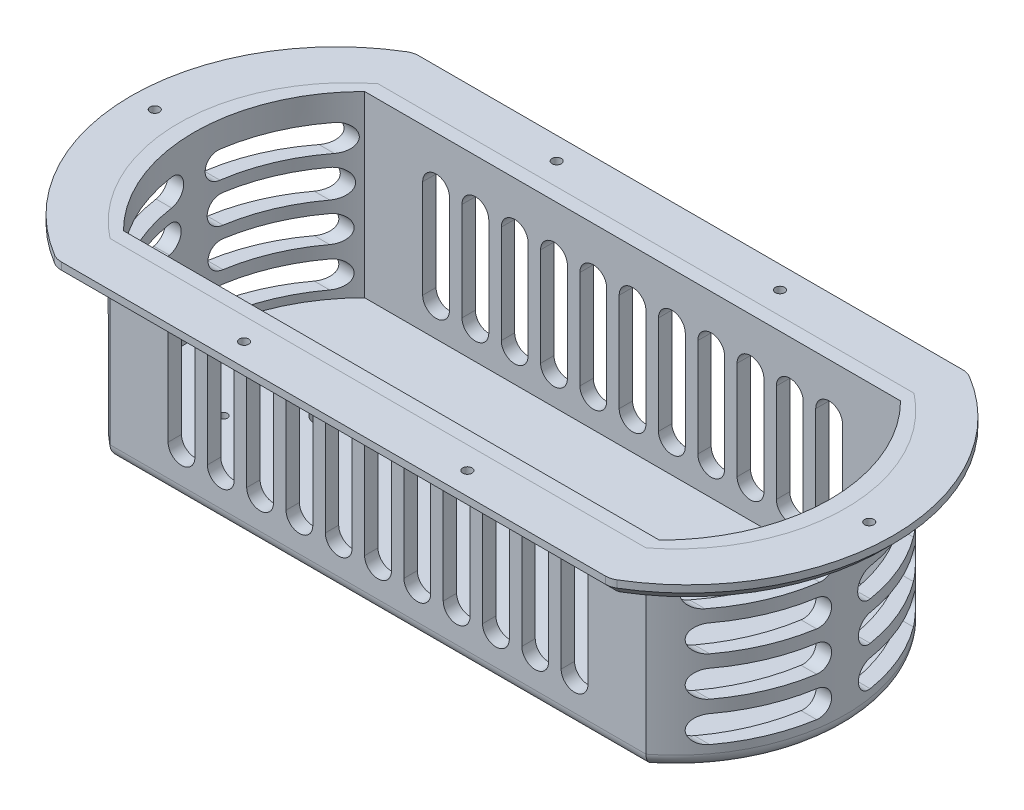
from build123d import *

# Parameters (mm, degrees)
BOSS_EXTRUDE1_DEPTH      = 10
BOSS_EXTRUDE2_DEPTH      = 100
CUT_EXTRUDE1_DEPTH       = 85
FILLET2_R                = 10
SKETCH10_R               = 4.6
CUT_EXTRUDE2_DEPTH       = 5
SKETCH10_3_R             = 4.6
CUT_EXTRUDE3_DEPTH       = 5
SKETCH10_4_R             = 4.6
CUT_EXTRUDE4_DEPTH       = 5
SKETCH10_5_R             = 4.6
CUT_EXTRUDE5_DEPTH       = 5
SKETCH10_6_R             = 4.6
CUT_EXTRUDE6_DEPTH       = 5
SKETCH10_7_R             = 4.6
CUT_EXTRUDE7_DEPTH       = 5
SKETCH12_R               = 2.6
CUT_EXTRUDE8_DEPTH       = 5
SKETCH12_3_R             = 2.6
CUT_EXTRUDE9_DEPTH       = 5
SKETCH12_4_R             = 2.6
CUT_EXTRUDE10_DEPTH      = 5
SKETCH12_5_R             = 2.6
CUT_EXTRUDE11_DEPTH      = 5
SKETCH12_6_R             = 2.6
CUT_EXTRUDE12_DEPTH      = 5
SKETCH12_7_R             = 2.6
CUT_EXTRUDE13_DEPTH      = 5
BOSS_EXTRUDE3_START      = 7.5
BOSS_EXTRUDE3_DEPTH      = 7.5
FILLET4_R                = 7.5
CUT_EXTRUDE17_DEPTH      = 15
CUT_EXTRUDE19_DEPTH      = 293.557934352
SKETCH46_R               = 2.35
CUT_EXTRUDE20_DEPTH      = 10
CUT_EXTRUDE21_DEPTH      = 190
CHAMFER1_SIZE            = 6
CUT_EXTRUDE23_START      = -100
CUT_EXTRUDE23_DEPTH      = 100
CUT_EXTRUDE26_DEPTH      = 259.872835489
CUT_EXTRUDE26_DEPTH_BACK = 259.872835489
SKETCH52_R               = 7.5


with BuildPart() as part:
    # Sketch2 → Boss-Extrude1 (new body)
    with BuildSketch(Plane(origin=(0, 0, 0), x_dir=(1, 0, 0), z_dir=(0, 1, 0))):
        with BuildLine():
            Line((-155, 100), (155, 100))
            ThreePointArc((155, 100), (213.210916542, 0), (155, -100))
            Line((155, -100), (-155, -100))
            ThreePointArc((-155, -100), (-213.210916542, 0), (-155, 100))
        make_face()
        with BuildLine():
            Line((150, 75), (-150, 75))
            ThreePointArc((-150, 75), (-186.690481052, 0), (-150, -75))
            Line((-150, -75), (150, -75))
            ThreePointArc((150, -75), (186.690481052, 0), (150, 75))
        make_face(mode=Mode.SUBTRACT)
    extrude(amount=BOSS_EXTRUDE1_DEPTH)

    # Fillet2
    fillet2_edges = [part.edges().sort_by_distance(p)[0] for p in [
        (-155, 5, -100),
        (155, 5, -100),
        (155, 5, 100),
        (-155, 5, 100),
    ]]
    fillet(fillet2_edges, radius=FILLET2_R)

    # Sketch10 → Cut-Extrude2 (cut)
    with BuildSketch(Plane.XZ):
        with Locations(Location((-199.950916542, 0, 0), (0, 0, 270))):
            Circle(SKETCH10_R)
    extrude(amount=-CUT_EXTRUDE2_DEPTH, mode=Mode.SUBTRACT)

    # Sketch10<3> → Cut-Extrude3 (cut)
    with BuildSketch(Plane.XZ):
        with Locations(Location((-62.5, -87.5, 0), (0, 0, 270))):
            Circle(SKETCH10_3_R)
    extrude(amount=-CUT_EXTRUDE3_DEPTH, mode=Mode.SUBTRACT)

    # Sketch10<4> → Cut-Extrude4 (cut)
    with BuildSketch(Plane.XZ):
        with Locations(Location((62.5, -87.5, 0), (0, 0, 270))):
            Circle(SKETCH10_4_R)
    extrude(amount=-CUT_EXTRUDE4_DEPTH, mode=Mode.SUBTRACT)

    # Sketch10<5> → Cut-Extrude5 (cut)
    with BuildSketch(Plane.XZ):
        with Locations(Location((199.950481052, 0, 0), (0, 0, 270))):
            Circle(SKETCH10_5_R)
    extrude(amount=-CUT_EXTRUDE5_DEPTH, mode=Mode.SUBTRACT)

    # Sketch10<6> → Cut-Extrude6 (cut)
    with BuildSketch(Plane.XZ):
        with Locations(Location((-62.5, 87.5, 0), (0, 0, 270))):
            Circle(SKETCH10_6_R)
    extrude(amount=-CUT_EXTRUDE6_DEPTH, mode=Mode.SUBTRACT)

    # Sketch10<7> → Cut-Extrude7 (cut)
    with BuildSketch(Plane.XZ):
        with Locations(Location((62.5, 87.5, 0), (0, 0, 270))):
            Circle(SKETCH10_7_R)
    extrude(amount=-CUT_EXTRUDE7_DEPTH, mode=Mode.SUBTRACT)

    # Sketch12 → Cut-Extrude8 (cut)
    with BuildSketch(Plane.XZ.offset(-5)):
        with Locations(Location((-199.950916542, 0, 0), (0, 0, 270))):
            Circle(SKETCH12_R)
    extrude(amount=-CUT_EXTRUDE8_DEPTH, mode=Mode.SUBTRACT)

    # Sketch12<3> → Cut-Extrude9 (cut)
    with BuildSketch(Plane.XZ.offset(-5)):
        with Locations(Location((-62.5, 87.5, 0), (0, 0, 270))):
            Circle(SKETCH12_3_R)
    extrude(amount=-CUT_EXTRUDE9_DEPTH, mode=Mode.SUBTRACT)

    # Sketch12<4> → Cut-Extrude10 (cut)
    with BuildSketch(Plane.XZ.offset(-5)):
        with Locations(Location((62.5, 87.5, 0), (0, 0, 270))):
            Circle(SKETCH12_4_R)
    extrude(amount=-CUT_EXTRUDE10_DEPTH, mode=Mode.SUBTRACT)

    # Sketch12<5> → Cut-Extrude11 (cut)
    with BuildSketch(Plane.XZ.offset(-5)):
        with Locations(Location((199.950481052, 0, 0), (0, 0, 270))):
            Circle(SKETCH12_5_R)
    extrude(amount=-CUT_EXTRUDE11_DEPTH, mode=Mode.SUBTRACT)

    # Sketch12<6> → Cut-Extrude12 (cut)
    with BuildSketch(Plane.XZ.offset(-5)):
        with Locations(Location((-62.5, -87.5, 0), (0, 0, 270))):
            Circle(SKETCH12_6_R)
    extrude(amount=-CUT_EXTRUDE12_DEPTH, mode=Mode.SUBTRACT)

    # Sketch12<7> → Cut-Extrude13 (cut)
    with BuildSketch(Plane.XZ.offset(-5)):
        with Locations(Location((62.5, -87.5, 0), (0, 0, 270))):
            Circle(SKETCH12_7_R)
    extrude(amount=-CUT_EXTRUDE13_DEPTH, mode=Mode.SUBTRACT)

    # Chamfer1
    chamfer1_edges = [part.edges().sort_by_distance(p)[0] for p in [
        (0, 0, 100),
        (-213.210916542, 0, 0),
        (0, 0, -100),
        (213.210916542, 0, 0),
        (154.966798093, 0, -99.636241117),
        (-154.966798093, 0, -99.636241117),
        (154.966798093, 0, 99.636241117),
        (-154.966798093, 0, 99.636241117),
    ]]
    chamfer(chamfer1_edges, length=CHAMFER1_SIZE)


with BuildPart() as body_2:
    # Sketch3 → Boss-Extrude2 (new body)
    with BuildSketch(Plane(origin=(0, 10, 0), x_dir=(1, 0, 0), z_dir=(0, 1, 0))):
        with BuildLine():
            Line((150, -75), (-150, -75))
            ThreePointArc((-150, -75), (-186.690481052, 0), (-150, 75))
            Line((-150, 75), (150, 75))
            ThreePointArc((150, 75), (186.690481052, 0), (150, -75))
        make_face()
    extrude(amount=-BOSS_EXTRUDE2_DEPTH)

    # Sketch6 → Cut-Extrude1 (cut)
    with BuildSketch(Plane(origin=(0, 10, 0), x_dir=(-1, 0, 0), z_dir=(0, 1, 0))):
        with BuildLine():
            Line((120, 67.5), (-120, 67.5))
            ThreePointArc((-120, 67.5), (-153.340054201, 0), (-120, -67.5))
            Line((-120, -67.5), (120, -67.5))
            ThreePointArc((120, -67.5), (153.340054201, 0), (120, 67.5))
        make_face()
    extrude(amount=-CUT_EXTRUDE1_DEPTH, mode=Mode.SUBTRACT)

    # Sketch35 → Boss-Extrude3 (add)
    with BuildSketch(Plane.XZ.offset(90).offset(BOSS_EXTRUDE3_START)):
        with BuildLine():
            Line((150, 75), (-150, 75))
            ThreePointArc((-150, 75), (-186.690481052, 0), (-150, -75))
            Line((-150, -75), (150, -75))
            ThreePointArc((150, -75), (186.690481052, 0), (150, 75))
        make_face()
    extrude(amount=-BOSS_EXTRUDE3_DEPTH)

    # Fillet4
    fillet4_edges = [body_2.edges().sort_by_distance(p)[0] for p in [
        (186.690481052, -97.5, 0),
        (0, -97.5, 75),
        (-186.690481052, -97.5, 0),
        (0, -97.5, -75),
    ]]
    fillet(fillet4_edges, radius=FILLET4_R)

    # Sketch39 → Cut-Extrude17 (cut)
    with BuildSketch(Plane(origin=(0, -75, 0), x_dir=(1, 0, 0), z_dir=(0, 1, 0))):
        with BuildLine():
            Line((120, 67.5), (-120, 67.5))
            ThreePointArc((-120, 67.5), (-153.340054201, 0), (-120, -67.5))
            Line((-120, -67.5), (120, -67.5))
            ThreePointArc((120, -67.5), (153.340054201, 0), (120, 67.5))
        make_face()
    extrude(amount=-CUT_EXTRUDE17_DEPTH, mode=Mode.SUBTRACT)

    # Sketch40 → Cut-Extrude19 (cut, through all)
    with BuildSketch(Plane(origin=(0, 0, -75), x_dir=(-1, 0, 0), z_dir=(0, 0, -1))):
        with BuildLine():
            Line((7.5, -17.5), (7.5, -72.5))
            ThreePointArc((7.5, -72.5), (0, -80), (-7.5, -72.5))
            Line((-7.5, -72.5), (-7.5, -17.5))
            ThreePointArc((-7.5, -17.5), (0, -10), (7.5, -17.5))
        make_face()
        with BuildLine():
            Line((14.5, -17.5), (14.5, -72.5))
            ThreePointArc((14.5, -72.5), (22, -80), (29.5, -72.5))
            Line((29.5, -72.5), (29.5, -17.5))
            ThreePointArc((29.5, -17.5), (22, -10), (14.5, -17.5))
        make_face()
        with BuildLine():
            Line((36.5, -17.5), (36.5, -72.5))
            ThreePointArc((36.5, -72.5), (44, -80), (51.5, -72.5))
            Line((51.5, -72.5), (51.5, -17.5))
            ThreePointArc((51.5, -17.5), (44, -10), (36.5, -17.5))
        make_face()
        with BuildLine():
            Line((58.5, -17.5), (58.5, -72.5))
            ThreePointArc((58.5, -72.5), (66, -80), (73.5, -72.5))
            Line((73.5, -72.5), (73.5, -17.5))
            ThreePointArc((73.5, -17.5), (66, -10), (58.5, -17.5))
        make_face()
        with BuildLine():
            Line((80.5, -17.5), (80.5, -72.5))
            ThreePointArc((80.5, -72.5), (88, -80), (95.5, -72.5))
            Line((95.5, -72.5), (95.5, -17.5))
            ThreePointArc((95.5, -17.5), (88, -10), (80.5, -17.5))
        make_face()
        with BuildLine():
            Line((102.5, -17.5), (102.5, -72.5))
            ThreePointArc((102.5, -72.5), (110, -80), (117.5, -72.5))
            Line((117.5, -72.5), (117.5, -17.5))
            ThreePointArc((117.5, -17.5), (110, -10), (102.5, -17.5))
        make_face()
        with BuildLine():
            Line((-29.5, -17.5), (-29.5, -72.5))
            ThreePointArc((-29.5, -72.5), (-22, -80), (-14.5, -72.5))
            Line((-14.5, -72.5), (-14.5, -17.5))
            ThreePointArc((-14.5, -17.5), (-22, -10), (-29.5, -17.5))
        make_face()
        with BuildLine():
            Line((-51.5, -17.5), (-51.5, -72.5))
            ThreePointArc((-51.5, -72.5), (-44, -80), (-36.5, -72.5))
            Line((-36.5, -72.5), (-36.5, -17.5))
            ThreePointArc((-36.5, -17.5), (-44, -10), (-51.5, -17.5))
        make_face()
        with BuildLine():
            Line((-73.5, -17.5), (-73.5, -72.5))
            ThreePointArc((-73.5, -72.5), (-66, -80), (-58.5, -72.5))
            Line((-58.5, -72.5), (-58.5, -17.5))
            ThreePointArc((-58.5, -17.5), (-66, -10), (-73.5, -17.5))
        make_face()
        with BuildLine():
            Line((-95.5, -17.5), (-95.5, -72.5))
            ThreePointArc((-95.5, -72.5), (-88, -80), (-80.5, -72.5))
            Line((-80.5, -72.5), (-80.5, -17.5))
            ThreePointArc((-80.5, -17.5), (-88, -10), (-95.5, -17.5))
        make_face()
        with BuildLine():
            Line((-117.5, -17.5), (-117.5, -72.5))
            ThreePointArc((-117.5, -72.5), (-110, -80), (-102.5, -72.5))
            Line((-102.5, -72.5), (-102.5, -17.5))
            ThreePointArc((-102.5, -17.5), (-110, -10), (-117.5, -17.5))
        make_face()
    extrude(amount=-CUT_EXTRUDE19_DEPTH, mode=Mode.SUBTRACT)

    # Sketch46 → Cut-Extrude20 (cut)
    with BuildSketch(Plane.XZ.offset(97.5)):
        with Locations(Location((-132.36812468, 29.26, 0), (0, 0, 270))):
            Circle(SKETCH46_R)
        with Locations(Location((-73.84812468, 29.26, 0), (0, 0, 270))):
            Circle(SKETCH46_R)
        with Locations(Location((-73.84812468, -29.26, 0), (0, 0, 270))):
            Circle(SKETCH46_R)
        with Locations(Location((-132.36812468, -29.26, 0), (0, 0, 270))):
            Circle(SKETCH46_R)
    extrude(amount=-CUT_EXTRUDE20_DEPTH, mode=Mode.SUBTRACT)

    # Sketch48 → Cut-Extrude21 (cut, symmetric)
    with BuildSketch(Plane(origin=(0, 0, 0), x_dir=(0, 0, -1), z_dir=(1, 0, 0))):
        with BuildLine():
            Line((-58.5, -4.5), (-13.5, -4.5))
            ThreePointArc((-13.5, -4.5), (-6, -12), (-13.5, -19.5))
            Line((-13.5, -19.5), (-58.5, -19.5))
            ThreePointArc((-58.5, -19.5), (-66, -12), (-58.5, -4.5))
        make_face()
        with BuildLine():
            Line((13.5, -4.5), (58.5, -4.5))
            ThreePointArc((58.5, -4.5), (66, -12), (58.5, -19.5))
            Line((58.5, -19.5), (13.5, -19.5))
            ThreePointArc((13.5, -19.5), (6, -12), (13.5, -4.5))
        make_face()
        with BuildLine():
            Line((-57, -26.5), (-15, -26.5))
            ThreePointArc((-15, -26.5), (-7.5, -34), (-15, -41.5))
            Line((-15, -41.5), (-57, -41.5))
            ThreePointArc((-57, -41.5), (-64.5, -34), (-57, -26.5))
        make_face()
        with BuildLine():
            Line((15, -26.073404774), (57, -26.073404774))
            ThreePointArc((57, -26.073404774), (64.926595226, -34), (57, -41.926595226))
            Line((57, -41.926595226), (15, -41.926595226))
            ThreePointArc((15, -41.926595226), (7.073404774, -34), (15, -26.073404774))
        make_face()
        with BuildLine():
            Line((-57, -48.5), (-15, -48.5))
            ThreePointArc((-15, -48.5), (-7.5, -56), (-15, -63.5))
            Line((-15, -63.5), (-57, -63.5))
            ThreePointArc((-57, -63.5), (-64.5, -56), (-57, -48.5))
        make_face()
        with BuildLine():
            Line((15, -48.5), (57, -48.5))
            ThreePointArc((57, -48.5), (64.5, -56), (57, -63.5))
            Line((57, -63.5), (15, -63.5))
            ThreePointArc((15, -63.5), (7.5, -56), (15, -48.5))
        make_face()
        with BuildLine():
            Line((-57, -70.5), (-15, -70.5))
            ThreePointArc((-15, -70.5), (-7.5, -78), (-15, -85.5))
            Line((-15, -85.5), (-57, -85.5))
            ThreePointArc((-57, -85.5), (-64.5, -78), (-57, -70.5))
        make_face()
        with BuildLine():
            Line((15, -70.5), (57, -70.5))
            ThreePointArc((57, -70.5), (64.5, -78), (57, -85.5))
            Line((57, -85.5), (15, -85.5))
            ThreePointArc((15, -85.5), (7.5, -78), (15, -70.5))
        make_face()
    extrude(amount=CUT_EXTRUDE21_DEPTH, both=True, mode=Mode.SUBTRACT)

    # Sketch50 → Cut-Extrude23 (cut)
    with BuildSketch(Plane(origin=(0, 10, 0), x_dir=(1, 0, 0), z_dir=(0, 1, 0)).offset(CUT_EXTRUDE23_START)):
        with BuildLine():
            Line((-120, 67.5), (-150, 67.5))
            ThreePointArc((-150, 67.5), (-177.95941546, 0), (-150, -67.5))
            Line((-150, -67.5), (-120, -67.5))
            ThreePointArc((-120, -67.5), (-153.340054201, 0), (-120, 67.5))
        make_face()
        with BuildLine():
            Line((120, 67.5), (150, 67.5))
            ThreePointArc((150, 67.5), (177.95941546, 0), (150, -67.5))
            Line((150, -67.5), (120, -67.5))
            ThreePointArc((120, -67.5), (153.340054201, 0), (120, 67.5))
        make_face()
    extrude(amount=CUT_EXTRUDE23_DEPTH, mode=Mode.SUBTRACT)

    # Sketch52 → Cut-Extrude26 (cut, two sides: drawn at the far end of the back side and taken through both)
    with BuildSketch(Plane.XZ.offset(97.5).offset(-CUT_EXTRUDE26_DEPTH_BACK)):
        with Locations(Location((-103.10812468, 0, 0), (0, 0, 270))):
            Circle(SKETCH52_R)
    extrude(amount=CUT_EXTRUDE26_DEPTH + CUT_EXTRUDE26_DEPTH_BACK, mode=Mode.SUBTRACT)


solid = Compound([part.part, body_2.part])
